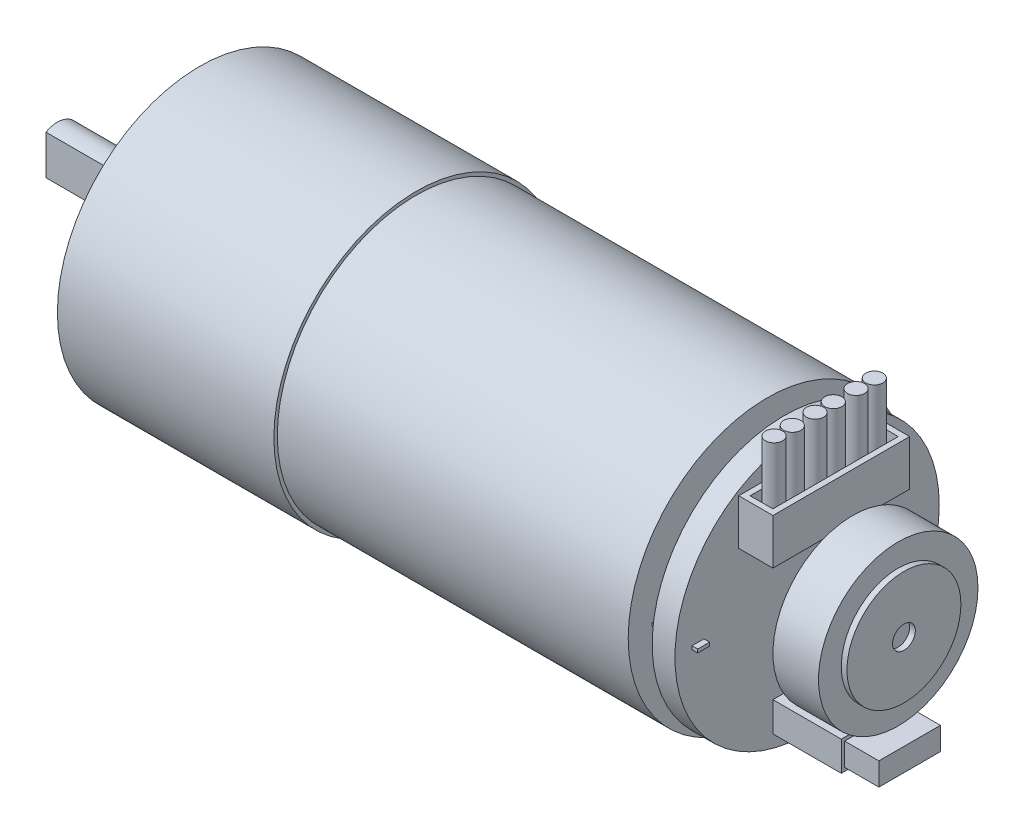
from build123d import *

# Parameters (mm, degrees)
CROQUIS3_R               = 12.5
SALIENTE_EXTRUIR1_DEPTH  = 19
CROQUIS8_R               = 3.5
SALIENTE_EXTRUIR3_DEPTH  = 2.5
CROQUIS9_R               = 2
SALIENTE_EXTRUIR4_DEPTH  = 12.5
CROQUIS10_W              = 8
CROQUIS10_H              = 4
CORTAR_EXTRUIR5_DEPTH    = 5
CROQUIS11_R              = 1.5
CORTAR_EXTRUIR6_DEPTH    = 3
CROQUIS12_R              = 2
CORTAR_EXTRUIR7_DEPTH    = 3
CORTAR_EXTRUIR8_DEPTH    = 1.5
CORTAR_EXTRUIR9_DEPTH    = 1.5
REDONDEO1_R              = 0.25
CROQUIS16_W              = 1.05
CROQUIS16_H              = 0.3
SALIENTE_EXTRUIR5_DEPTH  = 4
CROQUIS17_R              = 4
SALIENTE_EXTRUIR6_DEPTH  = 0.75
SALIENTE_EXTRUIR7_START  = 0.75
CROQUIS18_R              = 3.5
SALIENTE_EXTRUIR7_DEPTH  = 0.75
CROQUIS19_R              = 11.6
SALIENTE_EXTRUIR8_DEPTH  = 2
CROQUIS20_R              = 1
SALIENTE_EXTRUIR9_DEPTH  = 4
CROQUIS21_R              = 7
SALIENTE_EXTRUIR10_DEPTH = 4
CROQUIS22_R              = 5
SALIENTE_EXTRUIR11_DEPTH = 0.5
CORTAR_EXTRUIR10_START   = -0.5
CROQUIS23_R              = 1
CORTAR_EXTRUIR10_DEPTH   = 0.5
SALIENTE_EXTRUIR12_DEPTH = 3
CORTAR_EXTRUIR11_DEPTH   = 3.5
CROQUIS26_R              = 0.75
SALIENTE_EXTRUIR13_DEPTH = 8
SALIENTE_EXTRUIR14_DEPTH = 6
CROQUIS28_W              = 5.4
CROQUIS28_H              = 2
SALIENTE_EXTRUIR15_DEPTH = 3


with BuildPart() as part:
    # Croquis1 → Revolución-Lámina1 (revolve)
    with BuildSketch(Plane.XY, mode=Mode.PRIVATE) as revoluci_n_l_mina1_sk:
        Polygon((0, 0), (0, 12.2), (30.8, 12.2), (30.8, 0), (20.8, 0), (20.8, 2.2), (10, 2.2), (10, 0), align=None)
    revolve(revoluci_n_l_mina1_sk.sketch.rotate(Axis((0, 0, 0), (1, 0, 0)), 90), axis=Axis((0, 0, 0), (1, 0, 0)))

    # Croquis3 → Saliente-Extruir1 (add)
    with BuildSketch(Plane.ZY):
        Circle(CROQUIS3_R)
    extrude(amount=SALIENTE_EXTRUIR1_DEPTH)

    # Croquis8 → Saliente-Extruir3 (add)
    with BuildSketch(Plane.ZY.offset(19)):
        Circle(CROQUIS8_R)
    extrude(amount=SALIENTE_EXTRUIR3_DEPTH)

    # Croquis9 → Saliente-Extruir4 (add)
    with BuildSketch(Plane.ZY.offset(19)):
        Circle(CROQUIS9_R)
    extrude(amount=SALIENTE_EXTRUIR4_DEPTH)

    # Croquis10 → Cortar-Extruir5 (cut)
    with BuildSketch(Plane.XY.offset(1)):
        with Locations((-27.5, 0)):
            Rectangle(CROQUIS10_W, CROQUIS10_H)
    extrude(amount=CORTAR_EXTRUIR5_DEPTH, mode=Mode.SUBTRACT)

    # Croquis11 → Cortar-Extruir6 (cut)
    with BuildSketch(Plane.ZY.offset(19)):
        with Locations((-8, 0)):
            Circle(CROQUIS11_R)
        with Locations((8, 0)):
            Circle(CROQUIS11_R)
    extrude(amount=-CORTAR_EXTRUIR6_DEPTH, mode=Mode.SUBTRACT)

    # Croquis12 → Cortar-Extruir7 (cut)
    with BuildSketch(Plane.ZY.offset(19)):
        with Locations((0, -8.5)):
            Circle(CROQUIS12_R)
        with Locations((0, 8.5)):
            Circle(CROQUIS12_R)
    extrude(amount=-CORTAR_EXTRUIR7_DEPTH, mode=Mode.SUBTRACT)

    # Croquis14 → Cortar-Extruir8 (cut)
    with BuildSketch(Plane.ZY.offset(16)):
        Polygon((-0.25, 8.25), (-0.25, 7.2), (0.25, 7.2), (0.25, 8.25), (1.3, 8.25), (1.3, 8.75), (0.25, 8.75), (0.25, 9.8), (-0.25, 9.8), (-0.25, 8.75), (-1.3, 8.75), (-1.3, 8.25), align=None)
    extrude(amount=-CORTAR_EXTRUIR8_DEPTH, mode=Mode.SUBTRACT)

    # Croquis15 → Cortar-Extruir9 (cut)
    with BuildSketch(Plane.ZY.offset(16)):
        Polygon((-0.25, -8.75), (-0.25, -9.8), (0.25, -9.8), (0.25, -8.75), (1.3, -8.75), (1.3, -8.25), (0.25, -8.25), (0.25, -7.2), (-0.25, -7.2), (-0.25, -8.25), (-1.3, -8.25), (-1.3, -8.75), align=None)
    extrude(amount=-CORTAR_EXTRUIR9_DEPTH, mode=Mode.SUBTRACT)

    # Redondeo1
    redondeo1_edges = [part.edges().sort_by_distance(p)[0] for p in [
        (-16, -8.5, -2),
        (-16, 8.5, -2),
    ]]
    fillet(redondeo1_edges, radius=REDONDEO1_R)

    # Croquis16 → Saliente-Extruir5 (add)
    with BuildSketch(Plane(origin=(30.8, 0, 0), x_dir=(0, 0, -1), z_dir=(1, 0, 0))):
        with Locations((-9.575, 0)):
            Rectangle(CROQUIS16_W, CROQUIS16_H)
        with Locations((8.525, 0)):
            Rectangle(CROQUIS16_W, CROQUIS16_H)
    extrude(amount=SALIENTE_EXTRUIR5_DEPTH)

    # Croquis17 → Saliente-Extruir6 (add)
    with BuildSketch(Plane(origin=(30.8, 0, 0), x_dir=(0, 0, -1), z_dir=(1, 0, 0))):
        Circle(CROQUIS17_R)
    extrude(amount=SALIENTE_EXTRUIR6_DEPTH)

    # Croquis18 → Saliente-Extruir7 (add)
    with BuildSketch(Plane(origin=(31.55, 0, 0), x_dir=(0, 0, -1), z_dir=(1, 0, 0)).offset(SALIENTE_EXTRUIR7_START)):
        with Locations(Location((0, 0, 0), (0, 0, 180))):
            Circle(CROQUIS18_R)
    extrude(amount=-SALIENTE_EXTRUIR7_DEPTH)

    # Croquis19 → Saliente-Extruir8 (add)
    with BuildSketch(Plane(origin=(32.3, 0, 0), x_dir=(0, 0, -1), z_dir=(1, 0, 0))):
        Circle(CROQUIS19_R)
    extrude(amount=SALIENTE_EXTRUIR8_DEPTH)

    # Croquis20 → Saliente-Extruir9 (add)
    with BuildSketch(Plane(origin=(34.3, 0, 0), x_dir=(0, 0, -1), z_dir=(1, 0, 0))):
        Circle(CROQUIS20_R)
    extrude(amount=SALIENTE_EXTRUIR9_DEPTH)

    # Croquis21 → Saliente-Extruir10 (add)
    with BuildSketch(Plane(origin=(38.3, 0, 0), x_dir=(0, 0, -1), z_dir=(1, 0, 0))):
        Circle(CROQUIS21_R)
    extrude(amount=SALIENTE_EXTRUIR10_DEPTH)

    # Croquis22 → Saliente-Extruir11 (add)
    with BuildSketch(Plane(origin=(42.3, 0, 0), x_dir=(0, 0, -1), z_dir=(1, 0, 0))):
        Circle(CROQUIS22_R)
    extrude(amount=SALIENTE_EXTRUIR11_DEPTH)

    # Croquis23 → Cortar-Extruir10 (cut)
    with BuildSketch(Plane(origin=(42.8, 0, 0), x_dir=(0, 0, -1), z_dir=(1, 0, 0)).offset(CORTAR_EXTRUIR10_START)):
        Circle(CROQUIS23_R)
    extrude(amount=CORTAR_EXTRUIR10_DEPTH, mode=Mode.SUBTRACT)

    # Croquis24 → Saliente-Extruir12 (add)
    with BuildSketch(Plane(origin=(34.3, 0, 0), x_dir=(0, 0, -1), z_dir=(1, 0, 0))):
        Polygon((0, 9.5), (6, 9.5), (6, 5.5), (-6, 5.5), (-6, 9.5), align=None)
    extrude(amount=SALIENTE_EXTRUIR12_DEPTH)

    # Croquis25 → Cortar-Extruir11 (cut)
    with BuildSketch(Plane(origin=(0, 9.5, 0), x_dir=(1, 0, 0), z_dir=(0, 1, 0))):
        Polygon((36.8, -5.5), (36.8, 5.5), (34.8, 5.5), (34.8, -5.5), (35.8, -5.5), align=None)
    extrude(amount=-CORTAR_EXTRUIR11_DEPTH, mode=Mode.SUBTRACT)

    # Croquis26 → Saliente-Extruir13 (add)
    with BuildSketch(Plane(origin=(0, 6, 0), x_dir=(1, 0, 0), z_dir=(0, 1, 0))):
        with Locations(Location((35.8, -4.4, 0), (0, 0, 270))):
            Circle(CROQUIS26_R)
        with Locations(Location((35.8, -2.8, 0), (0, 0, 270))):
            Circle(CROQUIS26_R)
        with Locations(Location((35.8, -0.8, 0), (0, 0, 270))):
            Circle(CROQUIS26_R)
        with Locations(Location((35.8, 0.8, 0), (0, 0, 270))):
            Circle(CROQUIS26_R)
        with Locations(Location((35.8, 2.8, 0), (0, 0, 270))):
            Circle(CROQUIS26_R)
        with Locations(Location((35.8, 4.4, 0), (0, 0, 270))):
            Circle(CROQUIS26_R)
    extrude(amount=SALIENTE_EXTRUIR13_DEPTH)

    # Croquis27 → Saliente-Extruir14 (add)
    with BuildSketch(Plane(origin=(34.3, 0, 0), x_dir=(0, 0, -1), z_dir=(1, 0, 0))):
        Polygon((0, -10.1), (3, -10.1), (3, -7.5), (-3, -7.5), (-3, -10.1), align=None)
    extrude(amount=SALIENTE_EXTRUIR14_DEPTH)

    # Croquis28 → Saliente-Extruir15 (add)
    with BuildSketch(Plane(origin=(40.3, 0, 0), x_dir=(0, 0, -1), z_dir=(1, 0, 0))):
        with Locations((0, -8.8)):
            Rectangle(CROQUIS28_W, CROQUIS28_H)
    extrude(amount=SALIENTE_EXTRUIR15_DEPTH)


solid = part.part
